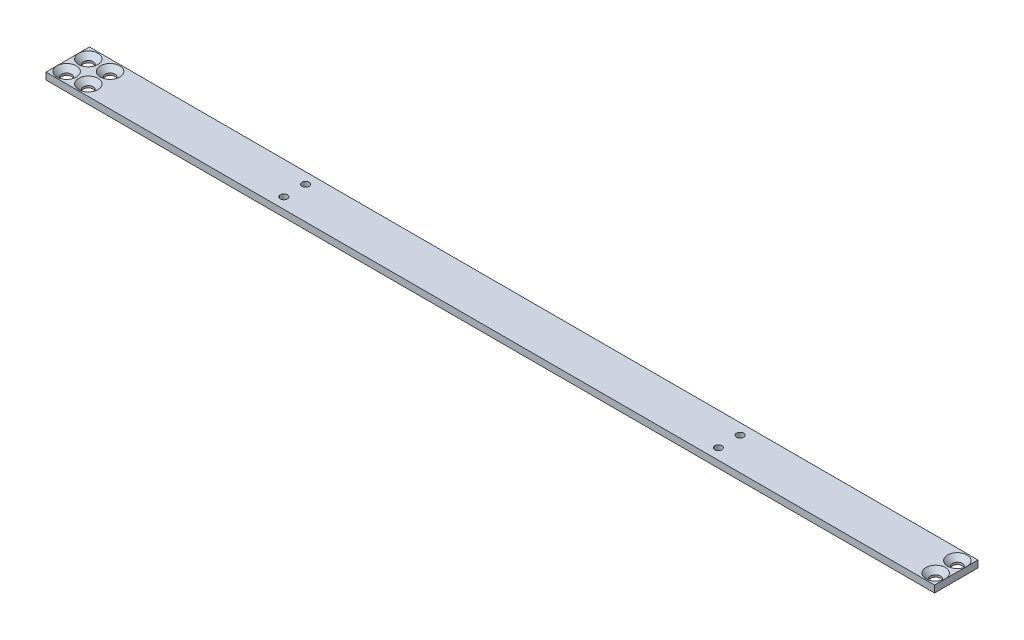
from build123d import *

# Parameters (mm, degrees)
SKETCH1_W                    = 409
SKETCH1_H                    = 20
BOSS_EXTRUDE1_DEPTH          = 3.175
CSK_FOR_M4_SFHCS1_AT_2_COUNT = 2
CSK_FOR_M4_SFHCS1_AT_2_PITCH = 14.142135624
CSK_FOR_M4_SFHCS1_AT_3_COUNT = 2
CSK_FOR_M4_SFHCS1_AT_3_PITCH = 10
CSK_FOR_M4_SFHCS1_AT_4_COUNT = 2
CSK_FOR_M4_SFHCS1_AT_4_PITCH = 10
CSK_FOR_M4_SFHCS1_AT_5_COUNT = 2
CSK_FOR_M4_SFHCS1_AT_5_PITCH = 390
CSK_FOR_M4_SFHCS1_AT_6_COUNT = 2
CSK_FOR_M4_SFHCS1_AT_6_PITCH = 390.128184063
M4X0_7_TAPPED_HOLE1_D        = 3.3


with BuildPart() as part:
    # Sketch1 → Boss-Extrude1 (new body)
    with BuildSketch(Plane(origin=(0, 0, 0), x_dir=(1, 0, 0), z_dir=(0, 1, 0))):
        Rectangle(SKETCH1_W, SKETCH1_H)
    extrude(amount=BOSS_EXTRUDE1_DEPTH)

    # Sketch4 → CSK for M4 SFHCS1 (revolve, cut)
    with BuildSketch(Plane(origin=(-190, 3.175, -5), x_dir=(0, 0, 1), z_dir=(1, 0, 0))):
        Polygon((0, 0), (0, 3.175), (2.25, 3.175), (2.25, 2.23), (4.48, 0), align=None)
    csk_for_m4_sfhcs1 = revolve(axis=Axis((-190, 9.525, -5), (0, -1, 0)), mode=Mode.SUBTRACT)

    # CSK for M4 SFHCS1 at 2: CSK for M4 SFHCS1 ×2
    with Locations(*[Vector(-0.7071067811865472, 0, 0.7071067811865479) * (i * CSK_FOR_M4_SFHCS1_AT_2_PITCH) for i in range(1, CSK_FOR_M4_SFHCS1_AT_2_COUNT)]):
        add(csk_for_m4_sfhcs1, mode=Mode.SUBTRACT)

    # CSK for M4 SFHCS1 at 3: CSK for M4 SFHCS1 ×2
    with Locations(*[(-i * CSK_FOR_M4_SFHCS1_AT_3_PITCH, 0, 0) for i in range(1, CSK_FOR_M4_SFHCS1_AT_3_COUNT)]):
        add(csk_for_m4_sfhcs1, mode=Mode.SUBTRACT)

    # CSK for M4 SFHCS1 at 4: CSK for M4 SFHCS1 ×2
    with Locations(*[(0, 0, i * CSK_FOR_M4_SFHCS1_AT_4_PITCH) for i in range(1, CSK_FOR_M4_SFHCS1_AT_4_COUNT)]):
        add(csk_for_m4_sfhcs1, mode=Mode.SUBTRACT)

    # CSK for M4 SFHCS1 at 5: CSK for M4 SFHCS1 ×2
    with Locations(*[(i * CSK_FOR_M4_SFHCS1_AT_5_PITCH, 0, 0) for i in range(1, CSK_FOR_M4_SFHCS1_AT_5_COUNT)]):
        add(csk_for_m4_sfhcs1, mode=Mode.SUBTRACT)

    # CSK for M4 SFHCS1 at 6: CSK for M4 SFHCS1 ×2
    with Locations(*[Vector(0.9996714309094813, 0, 0.025632600792550815) * (i * CSK_FOR_M4_SFHCS1_AT_6_PITCH) for i in range(1, CSK_FOR_M4_SFHCS1_AT_6_COUNT)]):
        add(csk_for_m4_sfhcs1, mode=Mode.SUBTRACT)

    # M4x0.7 Tapped Hole1 (through all)
    with Locations(Plane(origin=(0, 3.175, 0), x_dir=(1, 0, 0), z_dir=(0, 1, 0))):
        with Locations((100, 5), (-100, -5), (-100, 5), (100, -5)):
            Hole(M4X0_7_TAPPED_HOLE1_D / 2)


solid = part.part
